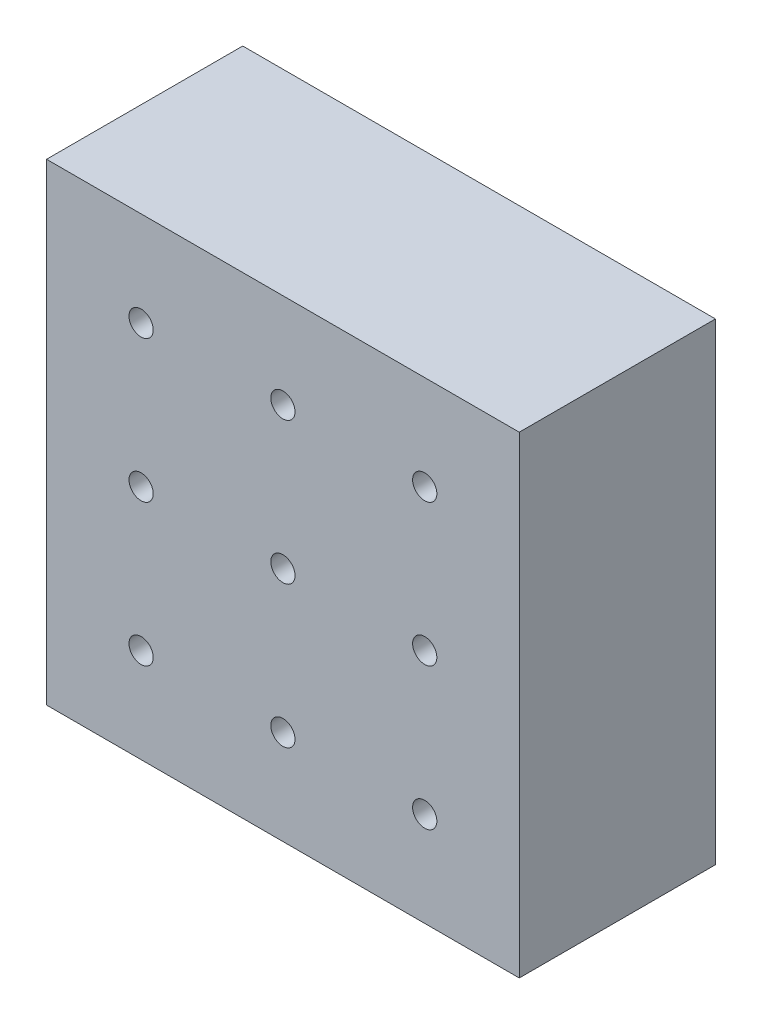
from build123d import *

# Parameters (mm, degrees)
SKETCH1_W           = 40
SKETCH1_H           = 40
SKETCH1_R           = 4.55
BOSS_EXTRUDE1_DEPTH = 1.6
SKETCH2_W           = 40
SKETCH2_H           = 40
SKETCH2_R           = 1.025
BOSS_EXTRUDE2_DEPTH = 15


with BuildPart() as part:
    # Sketch1 → Boss-Extrude1 (new body)
    with BuildSketch(Plane(origin=(0, 0, 0), x_dir=(0, 1, 0), z_dir=(0, 0, 1))):
        with Locations((12, 12)):
            Rectangle(SKETCH1_W, SKETCH1_H)
        with Locations(Location((0, 0, 0), (0, 0, 270))):
            Circle(SKETCH1_R, mode=Mode.SUBTRACT)
        with Locations(Location((12, 0, 0), (0, 0, 270))):
            Circle(SKETCH1_R, mode=Mode.SUBTRACT)
        with Locations(Location((24, 0, 0), (0, 0, 270))):
            Circle(SKETCH1_R, mode=Mode.SUBTRACT)
        with Locations(Location((12, 12, 0), (0, 0, 270))):
            Circle(SKETCH1_R, mode=Mode.SUBTRACT)
        with Locations(Location((24, 12, 0), (0, 0, 270))):
            Circle(SKETCH1_R, mode=Mode.SUBTRACT)
        with Locations(Location((12, 24, 0), (0, 0, 270))):
            Circle(SKETCH1_R, mode=Mode.SUBTRACT)
        with Locations(Location((24, 24, 0), (0, 0, 270))):
            Circle(SKETCH1_R, mode=Mode.SUBTRACT)
        with Locations(Location((0, 12, 0), (0, 0, 270))):
            Circle(SKETCH1_R, mode=Mode.SUBTRACT)
        with Locations(Location((0, 24, 0), (0, 0, 270))):
            Circle(SKETCH1_R, mode=Mode.SUBTRACT)
    extrude(amount=BOSS_EXTRUDE1_DEPTH)

    # Sketch2 → Boss-Extrude2 (add)
    with BuildSketch(Plane.XY.offset(1.6)):
        with Locations((-12, 12)):
            Rectangle(SKETCH2_W, SKETCH2_H)
        Circle(SKETCH2_R, mode=Mode.SUBTRACT)
        with Locations((-12, 0)):
            Circle(SKETCH2_R, mode=Mode.SUBTRACT)
        with Locations((-24, 0)):
            Circle(SKETCH2_R, mode=Mode.SUBTRACT)
        with Locations((-12, 12)):
            Circle(SKETCH2_R, mode=Mode.SUBTRACT)
        with Locations((-24, 12)):
            Circle(SKETCH2_R, mode=Mode.SUBTRACT)
        with Locations((-12, 24)):
            Circle(SKETCH2_R, mode=Mode.SUBTRACT)
        with Locations((-24, 24)):
            Circle(SKETCH2_R, mode=Mode.SUBTRACT)
        with Locations((0, 12)):
            Circle(SKETCH2_R, mode=Mode.SUBTRACT)
        with Locations((0, 24)):
            Circle(SKETCH2_R, mode=Mode.SUBTRACT)
    extrude(amount=BOSS_EXTRUDE2_DEPTH)


solid = part.part
